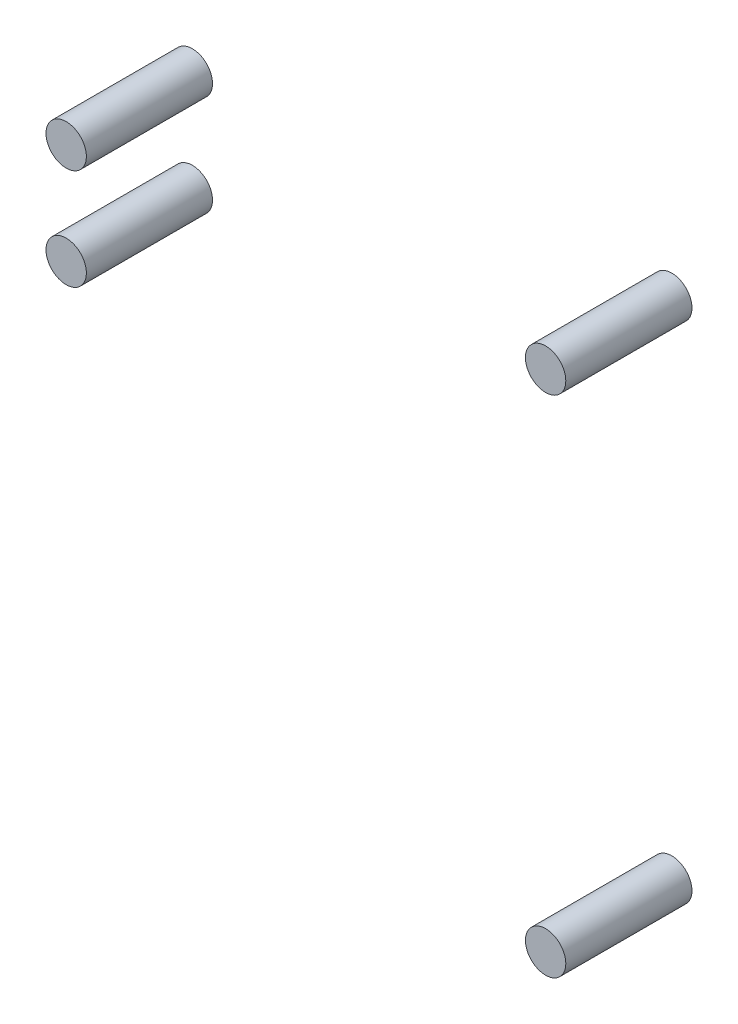
from build123d import *

# Parameters (mm, degrees)
BOSS_EXTRUDE1_DEPTH        = 5
BOSS_EXTRUDE1_DEPTH_BACK   = 7.5
SKETCH1_R                  = 2
BOSS_EXTRUDE1_2_DEPTH      = 5
BOSS_EXTRUDE1_2_DEPTH_BACK = 7.5
BOSS_EXTRUDE1_3_DEPTH      = 5
BOSS_EXTRUDE1_3_DEPTH_BACK = 7.5
BOSS_EXTRUDE1_4_DEPTH      = 5
BOSS_EXTRUDE1_4_DEPTH_BACK = 7.5


with BuildPart() as part:
    # Sketch1 → Boss-Extrude1 (new, two sides: drawn at the far end of the back side and taken through both)
    with BuildSketch(Plane.XY.offset(-BOSS_EXTRUDE1_DEPTH_BACK)):
        with Locations((27, 8.5)):
            Circle(SKETCH1_R)
    extrude(amount=BOSS_EXTRUDE1_DEPTH + BOSS_EXTRUDE1_DEPTH_BACK)


with BuildPart() as body_2:
    # Sketch1 → Boss-Extrude1 2 (new, two sides: drawn at the far end of the back side and taken through both)
    with BuildSketch(Plane.XY.offset(-BOSS_EXTRUDE1_2_DEPTH_BACK)):
        with Locations((27, 18.5)):
            Circle(SKETCH1_R)
    extrude(amount=BOSS_EXTRUDE1_2_DEPTH + BOSS_EXTRUDE1_2_DEPTH_BACK)


with BuildPart() as body_3:
    # Sketch1 → Boss-Extrude1 3 (new, two sides: drawn at the far end of the back side and taken through both)
    with BuildSketch(Plane.XY.offset(-BOSS_EXTRUDE1_3_DEPTH_BACK)):
        with Locations((74.5, 23)):
            Circle(SKETCH1_R)
    extrude(amount=BOSS_EXTRUDE1_3_DEPTH + BOSS_EXTRUDE1_3_DEPTH_BACK)


with BuildPart() as body_4:
    # Sketch1 → Boss-Extrude1 4 (new, two sides: drawn at the far end of the back side and taken through both)
    with BuildSketch(Plane.XY.offset(-BOSS_EXTRUDE1_4_DEPTH_BACK)):
        with Locations((74.5, -27)):
            Circle(SKETCH1_R)
    extrude(amount=BOSS_EXTRUDE1_4_DEPTH + BOSS_EXTRUDE1_4_DEPTH_BACK)


solid = Compound([part.part, body_2.part, body_3.part, body_4.part])
